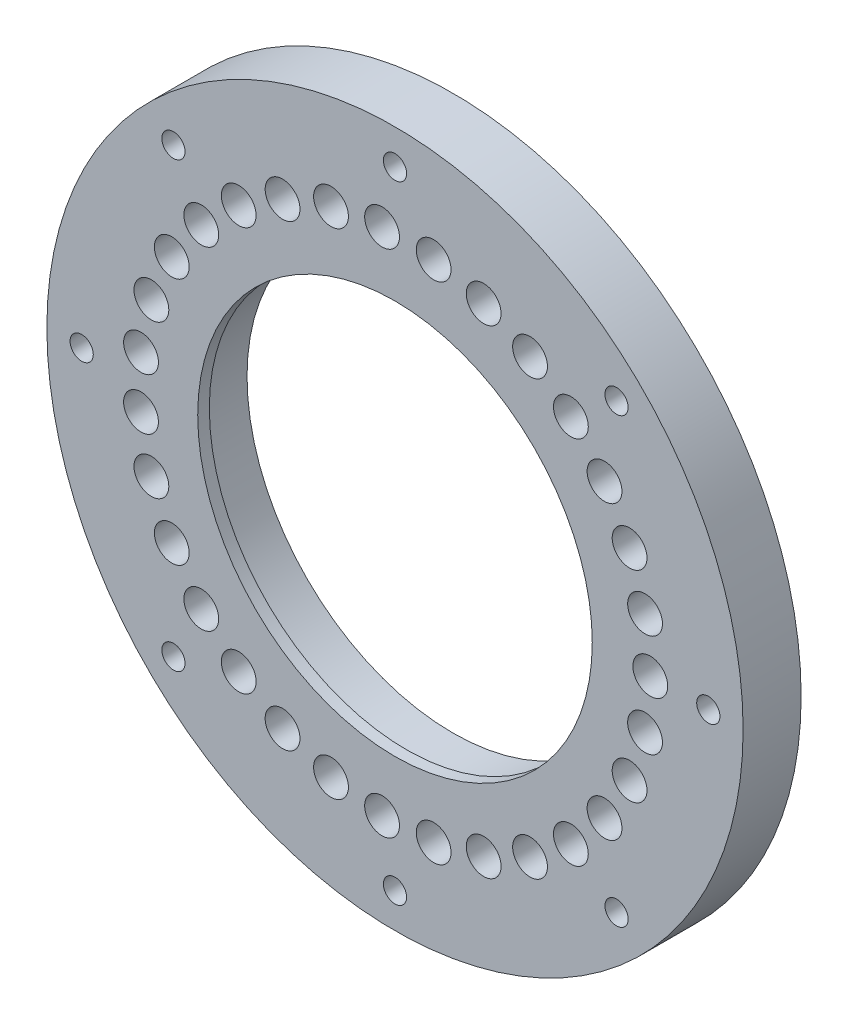
from build123d import *

# Parameters (mm, degrees)
SKETCH1_R           = 3
SKETCH1_R_2         = 34
BOSS_EXTRUDE1_DEPTH = 5
BOSS_EXTRUDE2_START = 5
SKETCH2_R           = 60
SKETCH2_R_2         = 10
BOSS_EXTRUDE2_DEPTH = 5
SKETCH3_R           = 2
CUT_EXTRUDE1_DEPTH  = 35
SKETCH5_R           = 35.5
CUT_EXTRUDE3_DEPTH  = 5
SKETCH6_R           = 35.5
CUT_EXTRUDE4_DEPTH  = 3
SKETCH7_R           = 93.527900111
SKETCH7_R_2         = 60
CUT_EXTRUDE5_DEPTH  = 10


with BuildPart() as part:
    # Sketch1 → Boss-Extrude1 (new body)
    with BuildSketch(Plane.XY):
        with BuildLine():
            ThreePointArc((59.930310696, 2.890996349), (-60, 0), (59.930310696, -2.890996349))
            ThreePointArc((59.930310696, -2.890996349), (62.891836179, 0), (59.930310696, 2.890996349))
        make_face()
        with Locations((44, 0)):
            Circle(SKETCH1_R, mode=Mode.SUBTRACT)
        with Locations((43.099317415, -8.857134884)):
            Circle(SKETCH1_R, mode=Mode.SUBTRACT)
        with Locations((40.434143711, -17.351657625)):
            Circle(SKETCH1_R, mode=Mode.SUBTRACT)
        with Locations((36.113591413, -25.135801464)):
            Circle(SKETCH1_R, mode=Mode.SUBTRACT)
        with Locations((30.314544439, -31.890882638)):
            Circle(SKETCH1_R, mode=Mode.SUBTRACT)
        with Locations((23.274416454, -37.34034733)):
            Circle(SKETCH1_R, mode=Mode.SUBTRACT)
        with Locations((15.281431125, -41.261093814)):
            Circle(SKETCH1_R, mode=Mode.SUBTRACT)
        with Locations((6.66282221, -43.49260627)):
            Circle(SKETCH1_R, mode=Mode.SUBTRACT)
        with Locations((-2.228563429, -43.943526316)):
            Circle(SKETCH1_R, mode=Mode.SUBTRACT)
        with Locations((-11.028711419, -42.59539323)):
            Circle(SKETCH1_R, mode=Mode.SUBTRACT)
        with Locations((-19.377342669, -39.503399741)):
            Circle(SKETCH1_R, mode=Mode.SUBTRACT)
        with Locations((-26.932663232, -34.794132425)):
            Circle(SKETCH1_R, mode=Mode.SUBTRACT)
        with Locations((-33.385357398, -28.66038924)):
            Circle(SKETCH1_R, mode=Mode.SUBTRACT)
        with Locations((-38.47125111, -21.353286351)):
            Circle(SKETCH1_R, mode=Mode.SUBTRACT)
        with Locations((-41.982127282, -13.171977411)):
            Circle(SKETCH1_R, mode=Mode.SUBTRACT)
        with Locations((-43.774250229, -4.451406167)):
            Circle(SKETCH1_R, mode=Mode.SUBTRACT)
        with Locations((-43.774250229, 4.451406167)):
            Circle(SKETCH1_R, mode=Mode.SUBTRACT)
        with Locations((-41.982127282, 13.171977411)):
            Circle(SKETCH1_R, mode=Mode.SUBTRACT)
        with Locations((-38.47125111, 21.353286351)):
            Circle(SKETCH1_R, mode=Mode.SUBTRACT)
        with Locations((-33.385357398, 28.66038924)):
            Circle(SKETCH1_R, mode=Mode.SUBTRACT)
        with Locations((-26.932663232, 34.794132425)):
            Circle(SKETCH1_R, mode=Mode.SUBTRACT)
        with Locations((-19.377342669, 39.503399741)):
            Circle(SKETCH1_R, mode=Mode.SUBTRACT)
        with Locations((-11.028711419, 42.59539323)):
            Circle(SKETCH1_R, mode=Mode.SUBTRACT)
        with Locations((-2.228563429, 43.943526316)):
            Circle(SKETCH1_R, mode=Mode.SUBTRACT)
        with Locations((6.66282221, 43.49260627)):
            Circle(SKETCH1_R, mode=Mode.SUBTRACT)
        with Locations((15.281431125, 41.261093814)):
            Circle(SKETCH1_R, mode=Mode.SUBTRACT)
        with Locations((23.274416454, 37.34034733)):
            Circle(SKETCH1_R, mode=Mode.SUBTRACT)
        with Locations((30.314544439, 31.890882638)):
            Circle(SKETCH1_R, mode=Mode.SUBTRACT)
        with Locations((36.113591413, 25.135801464)):
            Circle(SKETCH1_R, mode=Mode.SUBTRACT)
        with Locations((40.434143711, 17.351657625)):
            Circle(SKETCH1_R, mode=Mode.SUBTRACT)
        with Locations((43.099317415, 8.857134884)):
            Circle(SKETCH1_R, mode=Mode.SUBTRACT)
        Circle(SKETCH1_R_2, mode=Mode.SUBTRACT)
    extrude(amount=BOSS_EXTRUDE1_DEPTH)

    # Sketch2 → Boss-Extrude2 (add)
    with BuildSketch(Plane(origin=(0, 0, 0), x_dir=(-1, 0, 0), z_dir=(0, 0, -1)).offset(BOSS_EXTRUDE2_START)):
        Circle(SKETCH2_R)
        Circle(SKETCH2_R_2, mode=Mode.SUBTRACT)
    extrude(amount=-BOSS_EXTRUDE2_DEPTH)

    # Sketch3 → Cut-Extrude1 (cut)
    with BuildSketch(Plane.XY.offset(5)):
        with Locations((0, 54)):
            Circle(SKETCH3_R)
        with Locations((38.183766184, 38.183766184)):
            Circle(SKETCH3_R)
        with Locations((54, 0)):
            Circle(SKETCH3_R)
        with Locations((38.183766184, -38.183766184)):
            Circle(SKETCH3_R)
        with Locations((0, -54)):
            Circle(SKETCH3_R)
        with Locations((-38.183766184, -38.183766184)):
            Circle(SKETCH3_R)
        with Locations((-54, 0)):
            Circle(SKETCH3_R)
        with Locations((-38.183766184, 38.183766184)):
            Circle(SKETCH3_R)
    extrude(amount=-CUT_EXTRUDE1_DEPTH, mode=Mode.SUBTRACT)

    # Sketch5 → Cut-Extrude3 (cut)
    with BuildSketch(Plane(origin=(0, 0, -5), x_dir=(-1, 0, 0), z_dir=(0, 0, -1))):
        Circle(SKETCH5_R)
    extrude(amount=-CUT_EXTRUDE3_DEPTH, mode=Mode.SUBTRACT)

    # Sketch6 → Cut-Extrude4 (cut)
    with BuildSketch(Plane(origin=(0, 0, 0), x_dir=(-1, 0, 0), z_dir=(0, 0, -1))):
        Circle(SKETCH6_R)
    extrude(amount=-CUT_EXTRUDE4_DEPTH, mode=Mode.SUBTRACT)

    # Sketch7 → Cut-Extrude5 (cut)
    with BuildSketch(Plane(origin=(0, 0, -5), x_dir=(-1, 0, 0), z_dir=(0, 0, -1))):
        Circle(SKETCH7_R)
        Circle(SKETCH7_R_2, mode=Mode.SUBTRACT)
    extrude(amount=-CUT_EXTRUDE5_DEPTH, mode=Mode.SUBTRACT)


solid = part.part
